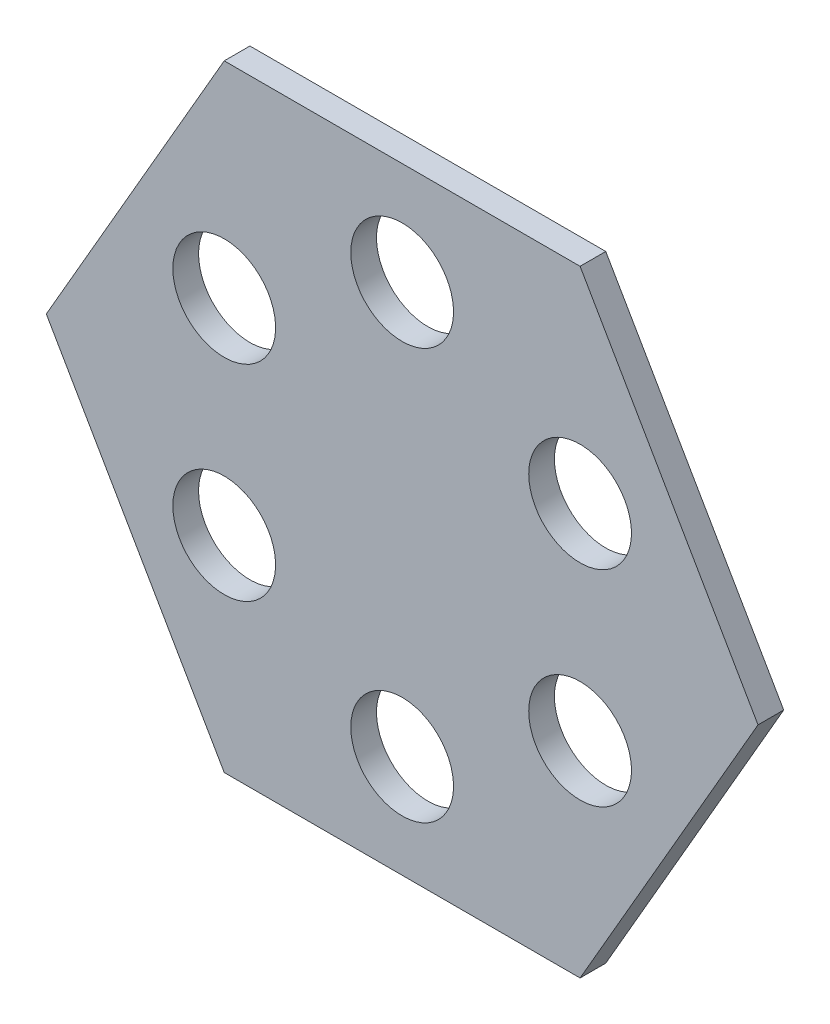
from build123d import *

# Parameters (mm, degrees)
SKETCH1_R           = 38.1
BOSS_EXTRUDE1_DEPTH = 19.05


with BuildPart() as part:
    # Sketch1 → Boss-Extrude1 (new body)
    # profile 1 of 6: a face of its own
    with BuildSketch(Plane.XY):
        Polygon((-263.964543073, 0), (-131.982271537, 228.6), (0, 0), align=None)
        with Locations(Location((-131.982271537, 76.2, 0), (0, 0, 180))):
            Circle(SKETCH1_R, mode=Mode.SUBTRACT)
    # profile 2 of 6: a face of its own
    with BuildSketch(Plane.XY):
        Polygon((131.982271537, 228.6), (0, 0), (-131.982271537, 228.6), align=None)
        with Locations(Location((0, 152.4, 0), (0, 0, 180))):
            Circle(SKETCH1_R, mode=Mode.SUBTRACT)
    # profile 3 of 6: a face of its own
    with BuildSketch(Plane.XY):
        Polygon((263.964543073, 0), (0, 0), (131.982271537, 228.6), align=None)
        with Locations(Location((131.982271537, 76.2, 0), (0, 0, 180))):
            Circle(SKETCH1_R, mode=Mode.SUBTRACT)
    # profile 4 of 6: a face of its own
    with BuildSketch(Plane.XY):
        Polygon((131.982271537, -228.6), (0, 0), (263.964543073, 0), align=None)
        with Locations(Location((131.982271537, -76.2, 0), (0, 0, 180))):
            Circle(SKETCH1_R, mode=Mode.SUBTRACT)
    # profile 5 of 6: a face of its own
    with BuildSketch(Plane.XY):
        Polygon((-131.982271537, -228.6), (0, 0), (131.982271537, -228.6), align=None)
        with Locations(Location((0, -152.4, 0), (0, 0, 180))):
            Circle(SKETCH1_R, mode=Mode.SUBTRACT)
    # profile 6 of 6: a face of its own
    with BuildSketch(Plane.XY):
        Polygon((-263.964543073, 0), (0, 0), (-131.982271537, -228.6), align=None)
        with Locations(Location((-131.982271537, -76.2, 0), (0, 0, 180))):
            Circle(SKETCH1_R, mode=Mode.SUBTRACT)
    extrude(amount=BOSS_EXTRUDE1_DEPTH)


solid = part.part
